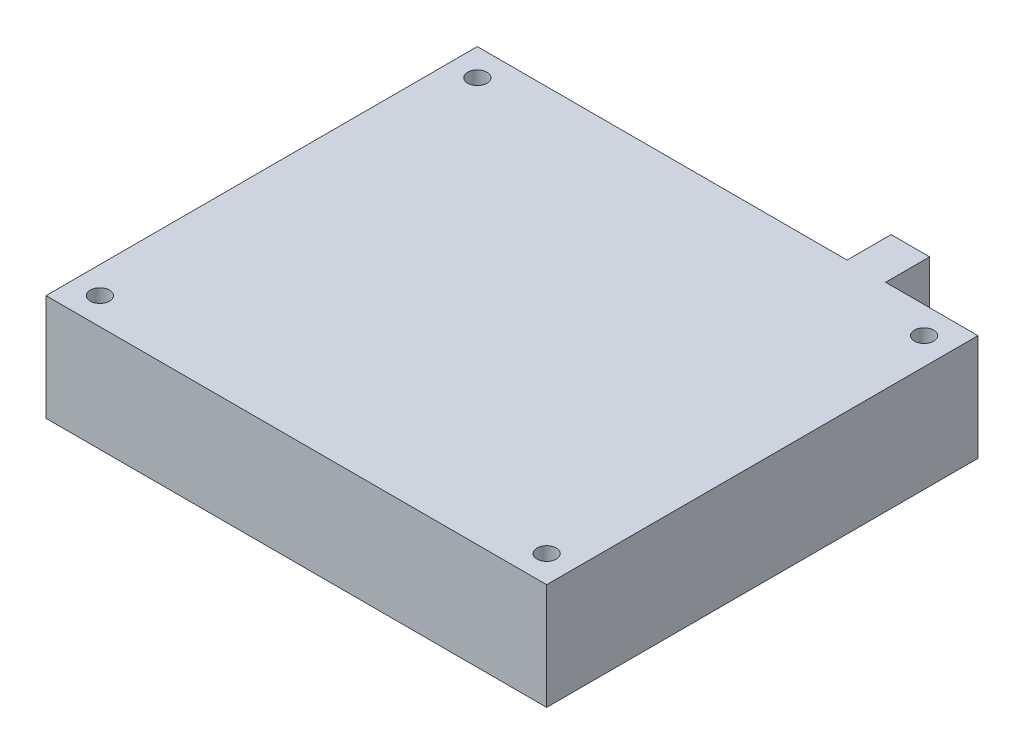
from build123d import *

# Parameters (mm, degrees)
SKETCH_2_R      = 1.25
EXTRUDE_1_DEPTH = 13.8


with BuildPart() as part:
    # 草图2 → 凸台-拉伸1 (new body)
    with BuildSketch(Plane(origin=(0, 0, 0), x_dir=(1, 0, 0), z_dir=(0, 1, 0))):
        Polygon((-32.5, 28), (15.5, 28), (15.5, 33.72), (20.5, 33.72), (20.5, 28), (32.5, 28), (32.5, -28), (-32.5, -28), align=None)
        with Locations(Location((-29, 24.5, 0), (0, 0, 270))):
            Circle(SKETCH_2_R, mode=Mode.SUBTRACT)
        with Locations(Location((-29, -24.5, 0), (0, 0, 270))):
            Circle(SKETCH_2_R, mode=Mode.SUBTRACT)
        with Locations(Location((29, 24.5, 0), (0, 0, 270))):
            Circle(SKETCH_2_R, mode=Mode.SUBTRACT)
        with Locations(Location((29, -24.5, 0), (0, 0, 270))):
            Circle(SKETCH_2_R, mode=Mode.SUBTRACT)
    extrude(amount=EXTRUDE_1_DEPTH)


solid = part.part
